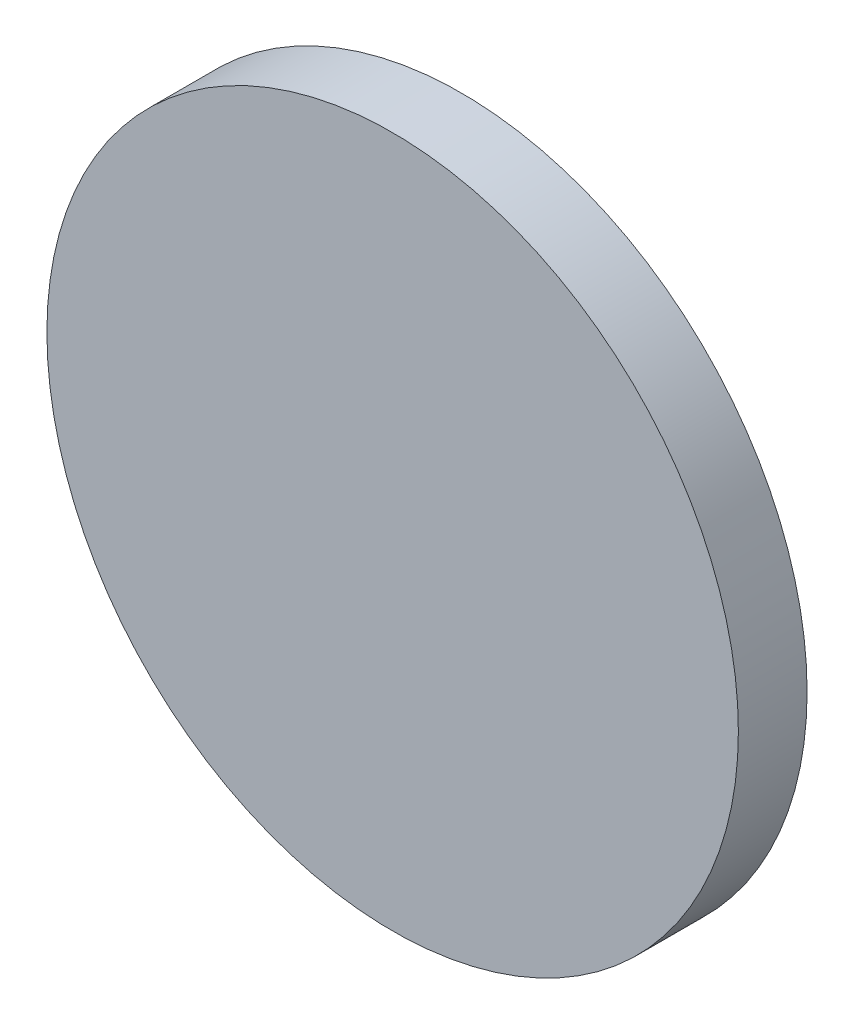
from build123d import *

# Parameters (mm, degrees)
SKETCH_1_R      = 100.623377409
EXTRUDE_1_DEPTH = 20


with BuildPart() as part:
    # Эскиз1 → Бобышка-Вытянуть1 (new body)
    with BuildSketch(Plane.XY):
        with Locations((-55.608479678, 37.638065741)):
            Circle(SKETCH_1_R)
    extrude(amount=EXTRUDE_1_DEPTH)


solid = part.part
